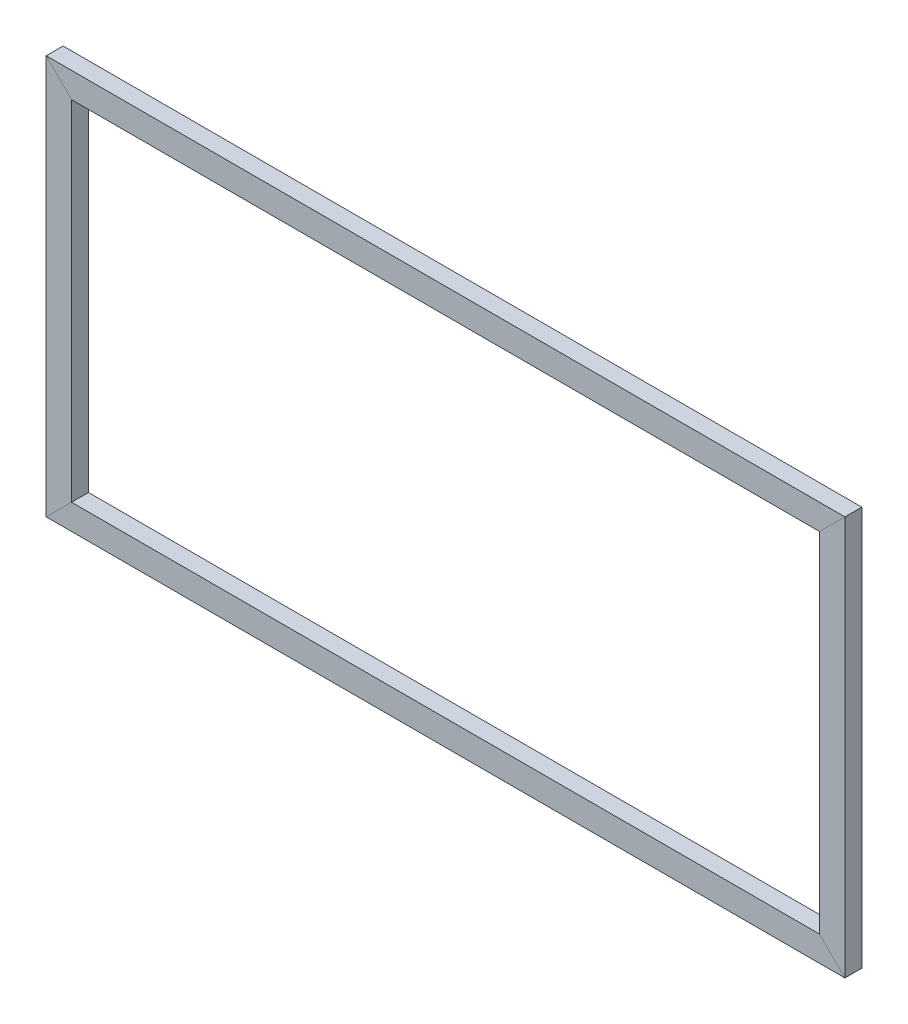
from build123d import *

# Parameters (mm, degrees)
AL_SOLID_PROFILES_0_75_X_0_5_1_DEPTH      = 593.3976253
AL_SOLID_PROFILES_0_75_X_0_5_1_DEPTH_BACK = 12.4476253
CROQUIS18_W                               = 19.05
CROQUIS18_H                               = 12.7
CROQUIS18_ON_SEGMENT_2_W                  = 19.05
CROQUIS18_ON_SEGMENT_2_H                  = 12.7
AL_SOLID_PROFILES_0_75_X_0_5_1_2_DEPTH    = 305.845250599
CROQUIS18_ON_SEGMENT_3_W                  = 19.05
CROQUIS18_ON_SEGMENT_3_H                  = 12.7
AL_SOLID_PROFILES_0_75_X_0_5_1_3_DEPTH    = 605.845250599
CROQUIS18_ON_SEGMENT_4_W                  = 19.05
CROQUIS18_ON_SEGMENT_4_H                  = 12.7
AL_SOLID_PROFILES_0_75_X_0_5_1_4_DEPTH    = 305.845250599


with BuildPart() as part:
    # Croquis18 → Al solid profiles 0.75 X 0.5(1) (new, two sides: drawn at the far end of the back side and taken through both)
    with BuildSketch(Plane(origin=(290.475, -140.475, 0), x_dir=(0, -1, 0), z_dir=(-1, 0, 0)).offset(-AL_SOLID_PROFILES_0_75_X_0_5_1_DEPTH_BACK)):
        Rectangle(CROQUIS18_W, CROQUIS18_H)
    extrude(amount=AL_SOLID_PROFILES_0_75_X_0_5_1_DEPTH + AL_SOLID_PROFILES_0_75_X_0_5_1_DEPTH_BACK)

    # Al solid profiles 0.75 X 0.5(1) mitre 1
    split(bisect_by=Plane(origin=(290.475, -140.475, 0), x_dir=(0.707106781, -0.707106781, 0), z_dir=(-0.707106781, -0.707106781, 0)), keep=Keep.TOP)

    # Al solid profiles 0.75 X 0.5(1) mitre 2
    split(bisect_by=Plane(origin=(-290.475, -140.475, 0), x_dir=(0.707106781, 0.707106781, 0), z_dir=(0.707106781, -0.707106781, 0)), keep=Keep.TOP)


with BuildPart() as body_2:
    # Croquis18 on segment 2 (carried to segment 2) → Al solid profiles 0.75 X 0.5_1 2 (new body)
    with BuildSketch(Plane(origin=(-290.475, -152.9226253, 0), x_dir=(-1, 0, 0), z_dir=(0, 1, 0))):
        Rectangle(CROQUIS18_ON_SEGMENT_2_W, CROQUIS18_ON_SEGMENT_2_H)
    extrude(amount=AL_SOLID_PROFILES_0_75_X_0_5_1_2_DEPTH)

    # Al solid profiles 0.75 X 0.5_1 2 mitre 1
    split(bisect_by=Plane(origin=(-290.475, 140.475, 0), x_dir=(0.707106781, -0.707106781, 0), z_dir=(-0.707106781, -0.707106781, 0)), keep=Keep.TOP)

    # Al solid profiles 0.75 X 0.5_1 2 mitre 2
    split(bisect_by=Plane(origin=(-290.475, -140.475, 0), x_dir=(-0.707106781, -0.707106781, 0), z_dir=(-0.707106781, 0.707106781, 0)), keep=Keep.TOP)


with BuildPart() as body_3:
    # Croquis18 on segment 3 (carried to segment 3) → Al solid profiles 0.75 X 0.5_1 3 (new body)
    with BuildSketch(Plane(origin=(-302.9226253, 140.475, 0), x_dir=(0, 1, 0), z_dir=(1, 0, 0))):
        Rectangle(CROQUIS18_ON_SEGMENT_3_W, CROQUIS18_ON_SEGMENT_3_H)
    extrude(amount=AL_SOLID_PROFILES_0_75_X_0_5_1_3_DEPTH)

    # Al solid profiles 0.75 X 0.5_1 3 mitre 1
    split(bisect_by=Plane(origin=(290.475, 140.475, 0), x_dir=(-0.707106781, -0.707106781, 0), z_dir=(-0.707106781, 0.707106781, 0)), keep=Keep.TOP)

    # Al solid profiles 0.75 X 0.5_1 3 mitre 2
    split(bisect_by=Plane(origin=(-290.475, 140.475, 0), x_dir=(-0.707106781, 0.707106781, 0), z_dir=(0.707106781, 0.707106781, 0)), keep=Keep.TOP)


with BuildPart() as body_4:
    # Croquis18 on segment 4 (carried to segment 4) → Al solid profiles 0.75 X 0.5_1 4 (new body)
    with BuildSketch(Plane(origin=(290.475, 152.9226253, 0), x_dir=(1, 0, 0), z_dir=(0, -1, 0))):
        Rectangle(CROQUIS18_ON_SEGMENT_4_W, CROQUIS18_ON_SEGMENT_4_H)
    extrude(amount=AL_SOLID_PROFILES_0_75_X_0_5_1_4_DEPTH)

    # Al solid profiles 0.75 X 0.5_1 4 mitre 1
    split(bisect_by=Plane(origin=(290.475, 140.475, 0), x_dir=(0.707106781, 0.707106781, 0), z_dir=(0.707106781, -0.707106781, 0)), keep=Keep.TOP)

    # Al solid profiles 0.75 X 0.5_1 4 mitre 2
    split(bisect_by=Plane(origin=(290.475, -140.475, 0), x_dir=(-0.707106781, 0.707106781, 0), z_dir=(0.707106781, 0.707106781, 0)), keep=Keep.TOP)


solid = Compound([part.part, body_2.part, body_3.part, body_4.part])
